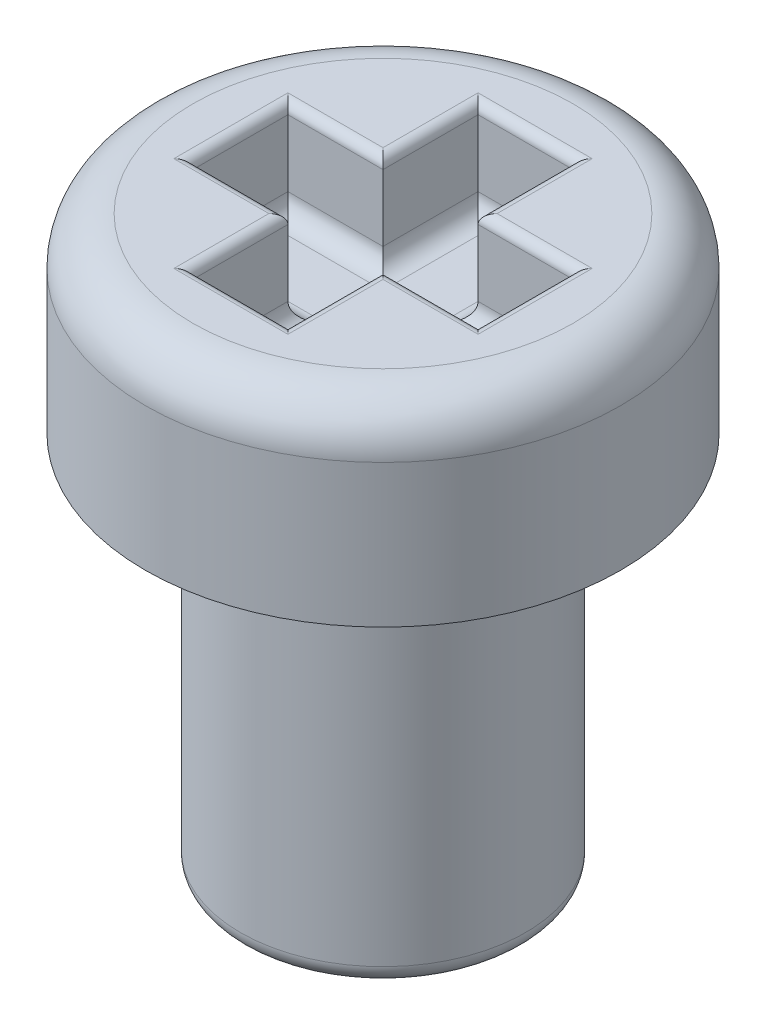
from build123d import *

# Parameters (mm, degrees)
SKETCH1_R           = 1.5
BOSS_EXTRUDE1_DEPTH = 4
FILLET1_R           = 0.2
SKETCH2_W           = 2.5
SKETCH2_H           = 2
CUT_EXTRUDE1_DEPTH  = 1
FILLET3_R           = 0.1
FILLET4_R           = 0.2
FILLET5_R           = 0.5


with BuildPart() as part:
    # Sketch1 → Boss-Extrude1 (new body)
    with BuildSketch(Plane(origin=(0, 0, 0), x_dir=(1, 0, 0), z_dir=(0, 1, 0))):
        with Locations(Location((0, 0, 0), (0, 0, 270))):
            Circle(SKETCH1_R)
    extrude(amount=BOSS_EXTRUDE1_DEPTH)

    # Fillet1
    fillet1_edges = [part.edges().sort_by_distance(p)[0] for p in [
        (0, 0, -1.5),
    ]]
    fillet(fillet1_edges, radius=FILLET1_R)

    # Sketch2 → Revolve1 (revolve)
    with BuildSketch(Plane.XY, mode=Mode.PRIVATE) as revolve1_sk:
        with Locations((-1.25, 5)):
            Rectangle(SKETCH2_W, SKETCH2_H)
    revolve(revolve1_sk.sketch.rotate(Axis((0, 0, 0), (0, 1, 0)), 270), axis=Axis((0, 0, 0), (0, 1, 0)))

    # Sketch3 → Cut-Extrude1 (cut)
    with BuildSketch(Plane(origin=(0, 6, 0), x_dir=(1, 0, 0), z_dir=(0, 1, 0))):
        Polygon((-0.5, 0.5), (-1.5, 0.5), (-1.5, -0.5), (-0.5, -0.5), (-0.5, -1.5), (0.5, -1.5), (0.5, -0.5), (1.5, -0.5), (1.5, 0.5), (0.5, 0.5), (0.5, 1.5), (-0.5, 1.5), align=None)
    extrude(amount=-CUT_EXTRUDE1_DEPTH, mode=Mode.SUBTRACT)

    # Fillet3
    fillet3_edges = [part.edges().sort_by_distance(p)[0] for p in [
        (0.5, 6, 1),
        (1, 6, 0.5),
        (1.5, 6, 0),
        (1, 6, -0.5),
        (0.5, 6, -1),
        (0, 6, -1.5),
        (-0.5, 6, -1),
        (-1, 6, -0.5),
        (-1.5, 6, 0),
        (-1, 6, 0.5),
        (-0.5, 6, 1),
        (0, 6, 1.5),
    ]]
    fillet(fillet3_edges, radius=FILLET3_R)

    # Fillet4
    fillet4_edges = [part.edges().sort_by_distance(p)[0] for p in [
        (0.5, 5, 1),
        (0, 5, 1.5),
        (-0.5, 5, 1),
        (-1, 5, 0.5),
        (-1.5, 5, 0),
        (-1, 5, -0.5),
        (-0.5, 5, -1),
        (0, 5, -1.5),
        (0.5, 5, -1),
        (1, 5, -0.5),
        (1.5, 5, 0),
        (1, 5, 0.5),
    ]]
    fillet(fillet4_edges, radius=FILLET4_R)

    # Fillet5
    fillet5_edges = [part.edges().sort_by_distance(p)[0] for p in [
        (0, 6, 2.5),
    ]]
    fillet(fillet5_edges, radius=FILLET5_R)


solid = part.part
